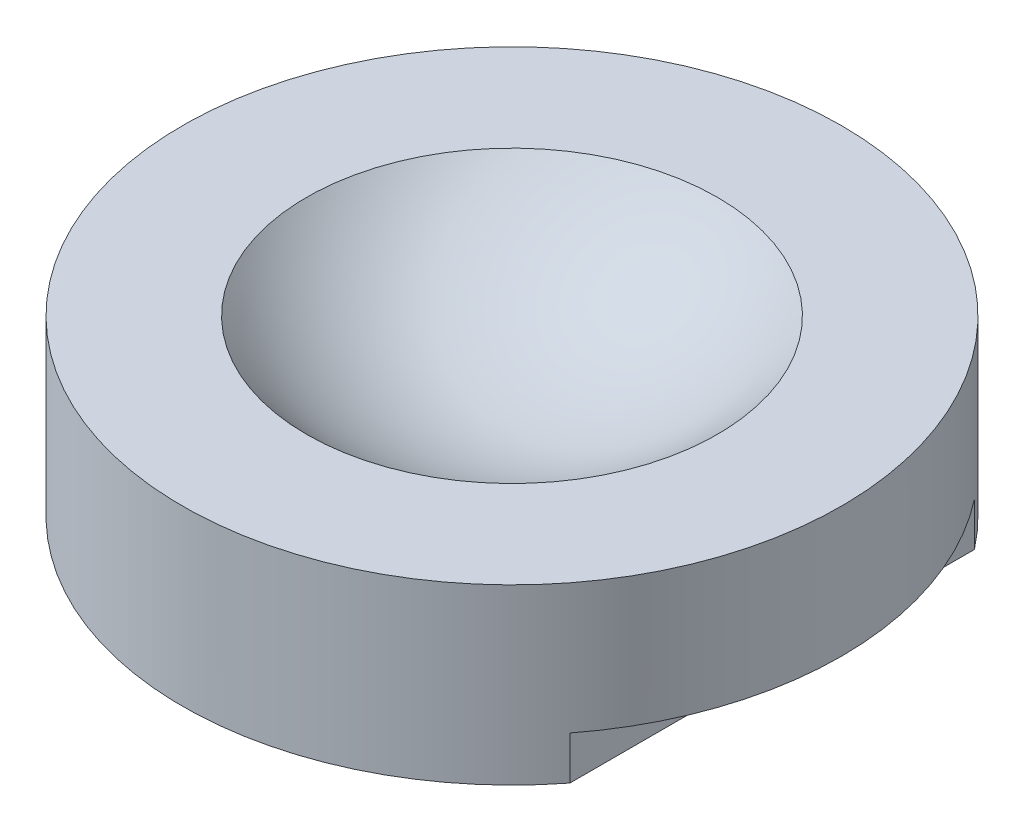
from build123d import *

# Parameters (mm, degrees)
KEYED_BACK_DEPTH   = 0.5
CUP_BLANK_SKETCH_R = 3.8
CUP_BLANK_DEPTH    = 1.5


with BuildPart() as part:
    # Keyed Back Sketch → Keyed Back (new body)
    with BuildSketch(Plane(origin=(0, -69, 0), x_dir=(-1, 0, 0), z_dir=(0, -1, 0))):
        with BuildLine():
            Line((23.291651246, 2.332380758), (23.291651246, -2.332380758))
            ThreePointArc((23.291651246, -2.332380758), (30.091651246, 0), (23.291651246, 2.332380758))
        make_face()
    extrude(amount=KEYED_BACK_DEPTH)

    # Cup Blank Sketch → Cup Blank (add)
    with BuildSketch(Plane(origin=(0, -69.5, 0), x_dir=(-1, 0, 0), z_dir=(0, -1, 0))):
        with Locations(Location((26.291651246, 0, 0), (0, 0, 217.863646362))):
            Circle(CUP_BLANK_SKETCH_R)
    extrude(amount=CUP_BLANK_DEPTH)

    # Spherical Bearing Seat profile → Spherical Bearing Seat (revolve, cut)
    with BuildSketch(Plane(origin=(0, -73, 0), x_dir=(-1, 0, 0), z_dir=(0, -1, 0))):
        with BuildLine():
            Line((26.291651246, -3.1), (26.291651246, 3.1))
            ThreePointArc((26.291651246, 3.1), (23.191651246, 0), (26.291651246, -3.1))
        make_face()
    revolve(axis=Axis((-26.291651246, -73, -10), (0, 0, 1)), mode=Mode.SUBTRACT)


with BuildPart() as body_2:
    # Mirror1: mirrored copy
    add(part.part.mirror(Plane(origin=(0, 0, 0), x_dir=(0, 0, 1), z_dir=(0, -1, 0))))


solid = body_2.part
